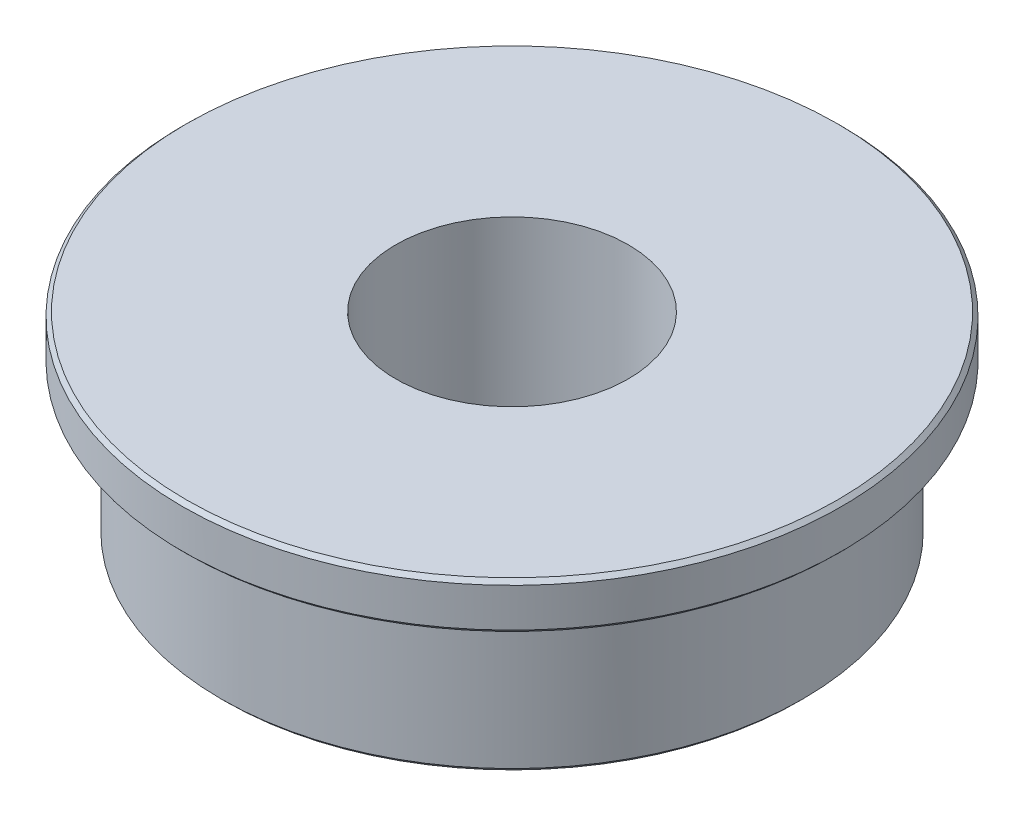
from build123d import *

# Parameters (mm, degrees)
CHAMFER_1_SIZE = 0.1


with BuildPart() as part:
    # 草图1 → 旋转1 (revolve)
    with BuildSketch(Plane.XY, mode=Mode.PRIVATE) as revolve_1_sk:
        Polygon((3, 0), (3, 5), (8.5, 5), (8.5, 3.8), (7.5, 3.8), (7.5, 0), align=None)
    revolve(revolve_1_sk.sketch.rotate(Axis((0, 0, 0), (0, 1, 0)), 90), axis=Axis((0, 0, 0), (0, 1, 0)))

    # 倒角1
    chamfer_1_edges = [part.edges().sort_by_distance(p)[0] for p in [
        (0, 0, 7.5),
        (0, 3.8, 8.5),
        (0, 5, 8.5),
    ]]
    chamfer(chamfer_1_edges, length=CHAMFER_1_SIZE)


solid = part.part
